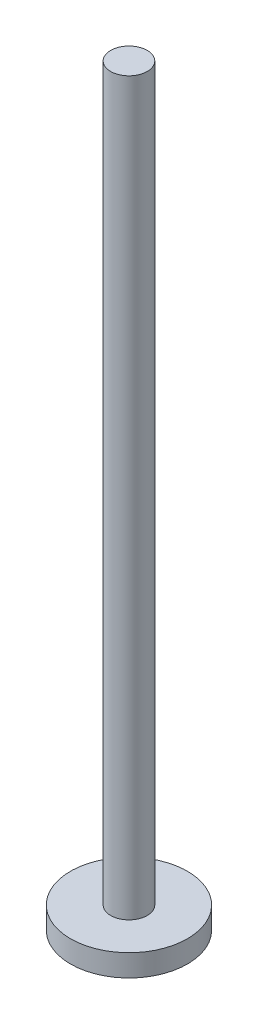
from build123d import *

# Parameters (mm, degrees)
SKETCH_1_R      = 8
EXTRUDE_1_DEPTH = 3
SKETCH_2_R      = 2.5
EXTRUDE_2_DEPTH = 100


with BuildPart() as part:
    # 草图1 → 凸台-拉伸1 (new body)
    with BuildSketch(Plane(origin=(0, 0, 0), x_dir=(1, 0, 0), z_dir=(0, 1, 0))):
        with Locations(Location((0, 0, 0), (0, 0, 270))):
            Circle(SKETCH_1_R)
    extrude(amount=EXTRUDE_1_DEPTH)

    # 草图2 → 凸台-拉伸2 (add)
    with BuildSketch(Plane(origin=(0, 3, 0), x_dir=(1, 0, 0), z_dir=(0, 1, 0))):
        with Locations(Location((0, 0, 0), (0, 0, 270))):
            Circle(SKETCH_2_R)
    extrude(amount=EXTRUDE_2_DEPTH)


solid = part.part
